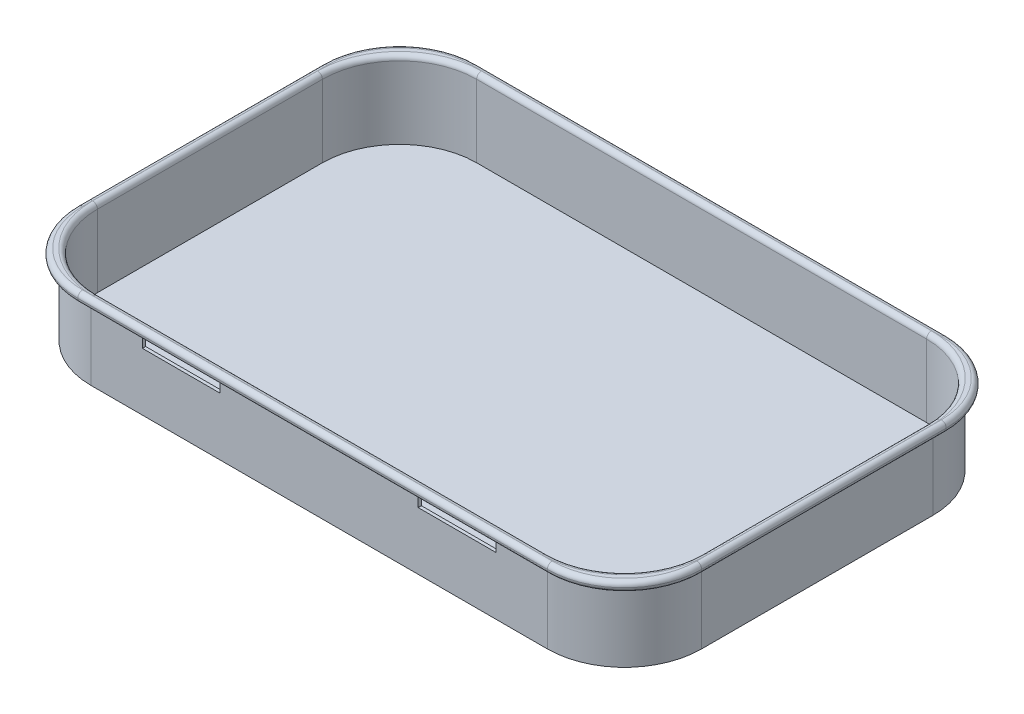
from build123d import *

# Parameters (mm, degrees)
SKETCH1_W           = 95
SKETCH1_H           = 60
BOSS_EXTRUDE1_DEPTH = 0.5
SKETCH2_W           = 95
SKETCH2_H           = 60
SKETCH2_W_2         = 94
SKETCH2_H_2         = 59
BOSS_EXTRUDE2_DEPTH = 10.5
SKETCH3_W           = 97.06
SKETCH3_H           = 62.06
SKETCH3_W_2         = 94
SKETCH3_H_2         = 59
BOSS_EXTRUDE3_DEPTH = 1.5
FILLET2_R           = 12
FILLET3_R           = 12
FILLET4_R           = 0.749
SKETCH4_W           = 12.1
SKETCH4_H           = 1.5
CUT_EXTRUDE1_DEPTH  = 0.5


with BuildPart() as part:
    # Sketch1 → Boss-Extrude1 (new body)
    with BuildSketch(Plane(origin=(0, 0, 0), x_dir=(1, 0, 0), z_dir=(0, 1, 0))):
        Rectangle(SKETCH1_W, SKETCH1_H)
    extrude(amount=BOSS_EXTRUDE1_DEPTH)

    # Sketch2 → Boss-Extrude2 (add)
    with BuildSketch(Plane(origin=(0, 0.5, 0), x_dir=(1, 0, 0), z_dir=(0, 1, 0))):
        Rectangle(SKETCH2_W, SKETCH2_H)
        Rectangle(SKETCH2_W_2, SKETCH2_H_2, mode=Mode.SUBTRACT)
    extrude(amount=BOSS_EXTRUDE2_DEPTH)

    # Sketch3 → Boss-Extrude3 (add)
    with BuildSketch(Plane(origin=(0, 11, 0), x_dir=(1, 0, 0), z_dir=(0, 1, 0))):
        Rectangle(SKETCH3_W, SKETCH3_H)
        Rectangle(SKETCH3_W_2, SKETCH3_H_2, mode=Mode.SUBTRACT)
    extrude(amount=BOSS_EXTRUDE3_DEPTH)

    # Fillet2
    fillet2_edges = [part.edges().sort_by_distance(p)[0] for p in [
        (-47, 6.5, 29.5),
        (47, 6.5, -29.5),
        (47, 6.5, 29.5),
        (-47.5, 5.5, -30),
    ]]
    fillet(fillet2_edges, radius=FILLET2_R)

    # Fillet3
    fillet3_edges = [part.edges().sort_by_distance(p)[0] for p in [
        (-47, 6.5, -29.5),
        (-48.53, 11.75, -31.03),
        (-48.53, 11.75, 31.03),
        (48.53, 11.75, 31.03),
        (48.53, 11.75, -31.03),
        (47.5, 5.5, -30),
        (47.5, 5.5, 30),
        (-47.5, 5.5, 30),
    ]]
    fillet(fillet3_edges, radius=FILLET3_R)

    # Fillet4
    fillet4_edges = [part.edges().sort_by_distance(p)[0] for p in [
        (0, 11, 31.03),
        (0, 12.5, 31.03),
        (-48.53, 11, 0),
        (-48.53, 12.5, 0),
        (48.53, 12.5, 0),
        (0, 12.5, -31.03),
        (-47, 12.5, 0),
        (45.015281374, 12.5, 27.515281374),
        (45.015281374, 12.5, -27.515281374),
        (-45.015281374, 12.5, 27.515281374),
        (0, 11, -31.03),
        (48.53, 11, 0),
        (-45.015281374, 11, -27.515281374),
        (-43.485281374, 12.5, -25.985281374),
        (45.015281374, 11, 27.515281374),
        (45.015281374, 11, -27.515281374),
        (-45.015281374, 11, 27.515281374),
        (-45.015281374, 12.5, -27.515281374),
        (47, 12.5, 0),
        (0, 12.5, -29.5),
        (0, 12.5, 29.5),
        (43.485281374, 12.5, -25.985281374),
        (43.485281374, 12.5, 25.985281374),
        (-43.485281374, 12.5, 25.985281374),
    ]]
    fillet(fillet4_edges, radius=FILLET4_R)

    # Sketch4 → Cut-Extrude1 (cut)
    with BuildSketch(Plane(origin=(0, 0, 29.5), x_dir=(-1, 0, 0), z_dir=(0, 0, -1))):
        with Locations((-21.45, 9.75)):
            Rectangle(SKETCH4_W, SKETCH4_H)
        with Locations((21.45, 9.75)):
            Rectangle(SKETCH4_W, SKETCH4_H)
    extrude(amount=-CUT_EXTRUDE1_DEPTH, mode=Mode.SUBTRACT)


solid = part.part
